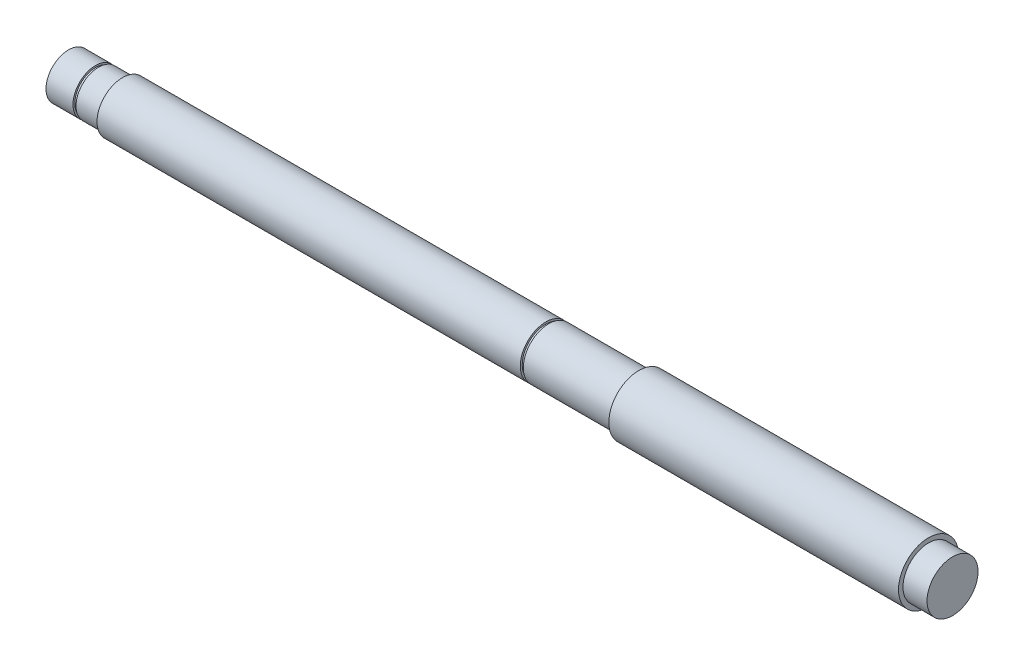
from build123d import *


with BuildPart() as part:
    # 草图1 → 旋转1 (revolve)
    with BuildSketch(Plane(origin=(0, 0, 0), x_dir=(1, 0, 0), z_dir=(0, 1, 0)), mode=Mode.PRIVATE) as revolve_1_sk:
        Polygon((0, 0), (0, 7.5), (9, 7.5), (9, 6.9), (10, 6.9), (10, 7.5), (18, 7.5), (18, 8.5), (159, 8.5), (159, 7.85), (160, 7.85), (160, 8.5), (190, 8.5), (190, 10), (286.5, 10), (286.5, 8.5), (294.5, 8.5), (294.5, 0), align=None)
    revolve(revolve_1_sk.sketch.rotate(Axis((-79.560771626, 0, 0), (1, 0, 0)), 180), axis=Axis((-79.560771626, 0, 0), (1, 0, 0)))


solid = part.part
